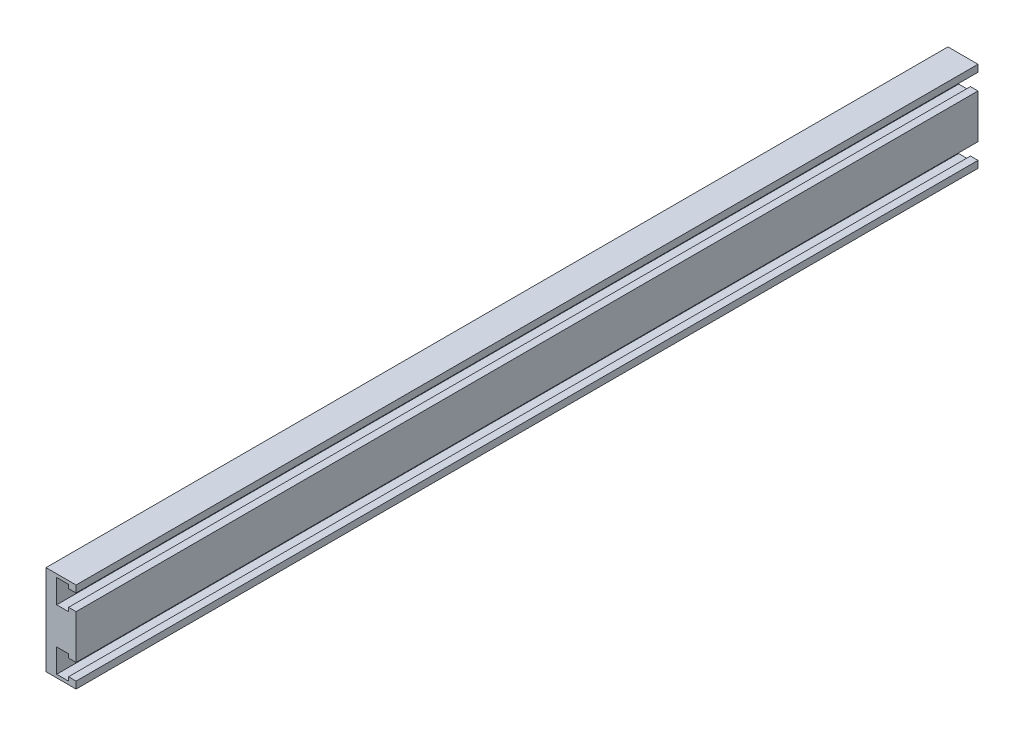
from build123d import *

# Parameters (mm, degrees)
BOSS_EXTRUDE1_DEPTH      = 190.5
BOSS_EXTRUDE1_DEPTH_BACK = 190.5


with BuildPart() as part:
    # Sketch1 → Boss-Extrude1 (new, two sides: drawn at the far end of the back side and taken through both)
    with BuildSketch(Plane.XY.offset(-BOSS_EXTRUDE1_DEPTH_BACK)):
        Polygon((-6.35, -19.05), (-6.35, 19.05), (6.35, 19.05), (6.35, 16.1125), (3.175, 16.1125), (3.175, 17.7), (-1.825, 17.7), (-1.825, 7.7), (3.175, 7.7), (3.175, 9.2875), (6.35, 9.2875), (6.35, -9.2875), (3.175, -9.2875), (3.175, -7.7), (-1.825, -7.7), (-1.825, -17.7), (3.175, -17.7), (3.175, -16.1125), (6.35, -16.1125), (6.35, -19.05), align=None)
    extrude(amount=BOSS_EXTRUDE1_DEPTH + BOSS_EXTRUDE1_DEPTH_BACK)


solid = part.part
